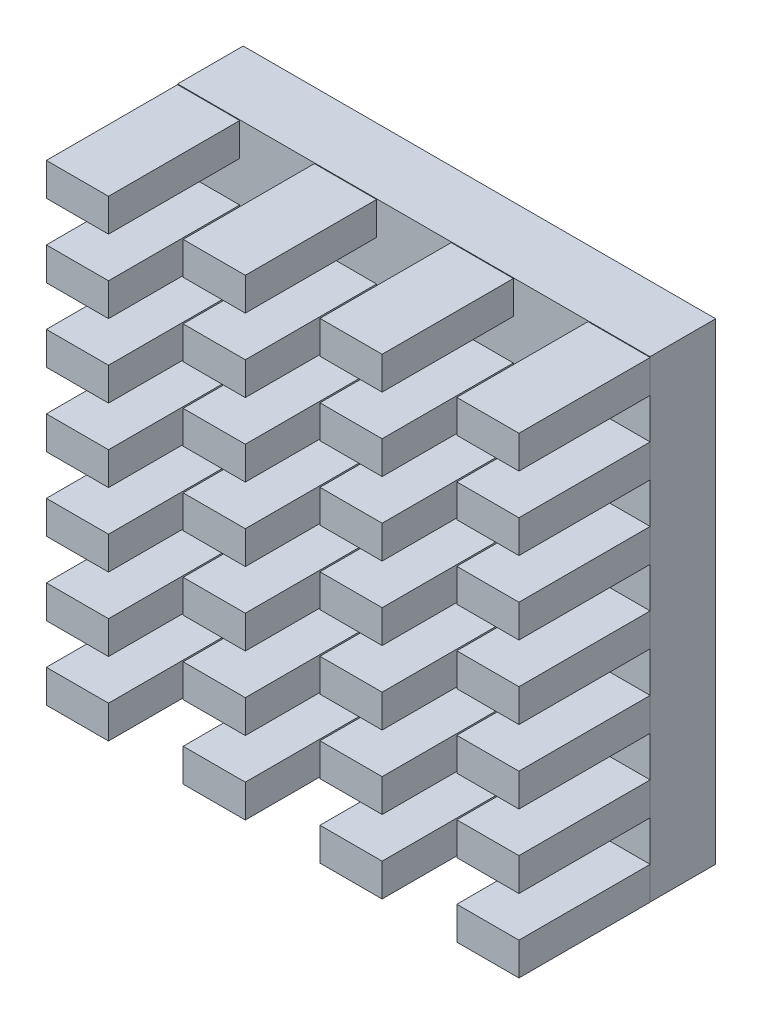
from build123d import *

# Parameters (mm, degrees)
CROQUIS1_W              = 14.4
CROQUIS1_H              = 14.4
SALIENTE_EXTRUIR1_DEPTH = 2
CROQUIS2_W              = 1.894290675
CROQUIS2_H              = 1
SALIENTE_EXTRUIR2_DEPTH = 4


with BuildPart() as part:
    # Croquis1 → Saliente-Extruir1 (new body)
    with BuildSketch(Plane.XY):
        Rectangle(CROQUIS1_W, CROQUIS1_H)
    extrude(amount=SALIENTE_EXTRUIR1_DEPTH)

    # Croquis2 → Saliente-Extruir2 (add)
    with BuildSketch(Plane.XY.offset(2)):
        with Locations((-2.082854662, -6.7)):
            Rectangle(CROQUIS2_W, CROQUIS2_H)
        with Locations((-6.252854663, -6.7)):
            Rectangle(CROQUIS2_W, CROQUIS2_H)
        with Locations((2.087145337, -6.7)):
            Rectangle(CROQUIS2_W, CROQUIS2_H)
        with Locations((6.257145338, -6.7)):
            Rectangle(CROQUIS2_W, CROQUIS2_H)
        with Locations((-2.082854662, -4.47)):
            Rectangle(CROQUIS2_W, CROQUIS2_H)
        with Locations((2.087145337, -4.47)):
            Rectangle(CROQUIS2_W, CROQUIS2_H)
        with Locations((6.257145338, -4.47)):
            Rectangle(CROQUIS2_W, CROQUIS2_H)
        with Locations((-2.082854662, -2.24)):
            Rectangle(CROQUIS2_W, CROQUIS2_H)
        with Locations((2.087145337, -2.24)):
            Rectangle(CROQUIS2_W, CROQUIS2_H)
        with Locations((6.257145338, -2.24)):
            Rectangle(CROQUIS2_W, CROQUIS2_H)
        with Locations((-2.082854662, -0.01)):
            Rectangle(CROQUIS2_W, CROQUIS2_H)
        with Locations((2.087145337, -0.01)):
            Rectangle(CROQUIS2_W, CROQUIS2_H)
        with Locations((6.257145338, -0.01)):
            Rectangle(CROQUIS2_W, CROQUIS2_H)
        with Locations((-2.082854662, 2.22)):
            Rectangle(CROQUIS2_W, CROQUIS2_H)
        with Locations((2.087145337, 2.22)):
            Rectangle(CROQUIS2_W, CROQUIS2_H)
        with Locations((6.257145338, 2.22)):
            Rectangle(CROQUIS2_W, CROQUIS2_H)
        with Locations((-2.082854662, 4.45)):
            Rectangle(CROQUIS2_W, CROQUIS2_H)
        with Locations((2.087145337, 4.45)):
            Rectangle(CROQUIS2_W, CROQUIS2_H)
        with Locations((6.257145338, 4.45)):
            Rectangle(CROQUIS2_W, CROQUIS2_H)
        with Locations((-2.082854662, 6.68)):
            Rectangle(CROQUIS2_W, CROQUIS2_H)
        with Locations((2.087145337, 6.68)):
            Rectangle(CROQUIS2_W, CROQUIS2_H)
        with Locations((6.257145338, 6.68)):
            Rectangle(CROQUIS2_W, CROQUIS2_H)
        with Locations((-6.252854663, -4.47)):
            Rectangle(CROQUIS2_W, CROQUIS2_H)
        with Locations((-6.252854663, -2.24)):
            Rectangle(CROQUIS2_W, CROQUIS2_H)
        with Locations((-6.252854663, -0.01)):
            Rectangle(CROQUIS2_W, CROQUIS2_H)
        with Locations((-6.252854663, 2.22)):
            Rectangle(CROQUIS2_W, CROQUIS2_H)
        with Locations((-6.252854663, 4.45)):
            Rectangle(CROQUIS2_W, CROQUIS2_H)
        with Locations((-6.252854663, 6.68)):
            Rectangle(CROQUIS2_W, CROQUIS2_H)
    extrude(amount=SALIENTE_EXTRUIR2_DEPTH)


solid = part.part
